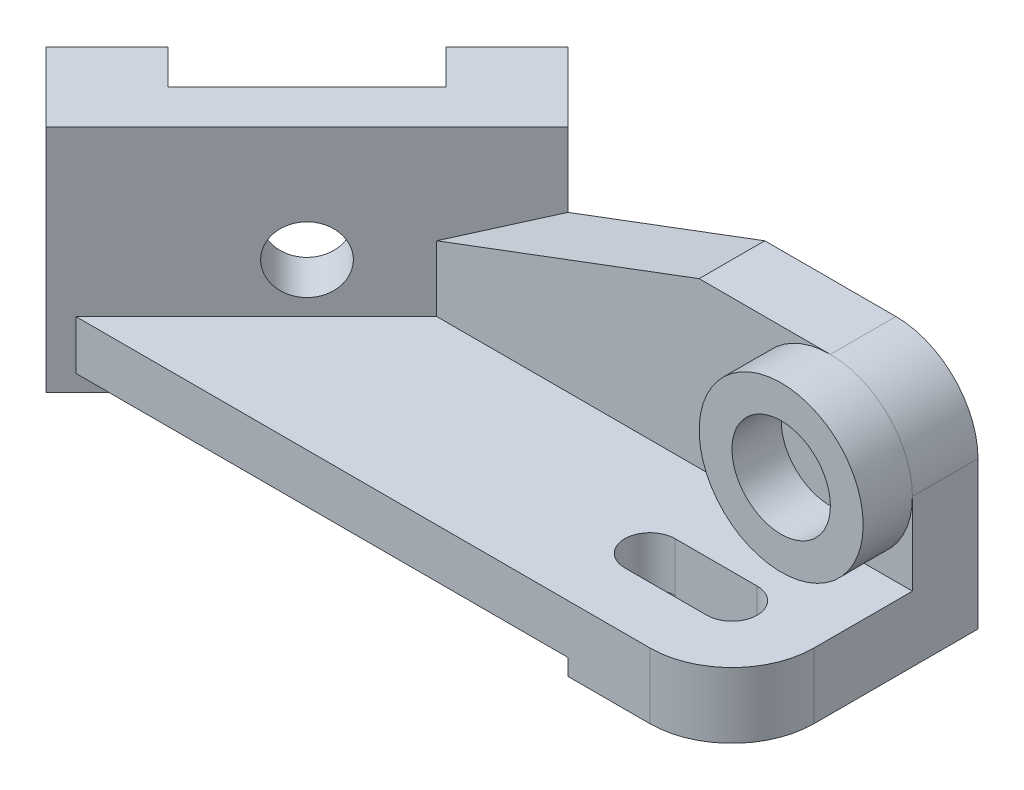
from build123d import *

# Parameters (mm, degrees)
BOSS_EXTRUDE1_DEPTH  = 150
FILLET1_R            = 50
CUT_EXTRUDE1_REACH   = 431.069
CUT_EXTRUDE2_DEPTH   = 430.068759058
BOSS_EXTRUDE2_DEPTH  = 140
CUT_EXTRUDE3_DEPTH   = 225
CUT_EXTRUDE4_REACH   = 356.524
SKETCH7_R            = 20
BOSS_EXTRUDE3_DEPTH  = 100
SKETCH11_R           = 50
BOSS_EXTRUDE9_DEPTH  = 30
BOSS_EXTRUDE9_TAPER  = 0.01
FILLET3_R            = 50
SKETCH12_R           = 30
CUT_EXTRUDE5_DEPTH   = 30
CUT_EXTRUDE7_REACH   = 489.504
BOSS_EXTRUDE11_REACH = 512.395
CUT_EXTRUDE8_DEPTH   = 490.482620533


with BuildPart() as part:
    # Sketch1 → Boss-Extrude1 (new body)
    with BuildSketch(Plane.XY):
        Polygon((0, 0), (-100, 0), (-100, 10), (-400, 10), (-400, 40), (0, 40), align=None)
    extrude(amount=-BOSS_EXTRUDE1_DEPTH)

    # Fillet1
    fillet1_edges = [part.edges().sort_by_distance(p)[0] for p in [
        (0, 20, 0),
    ]]
    fillet(fillet1_edges, radius=FILLET1_R)

    # Sketch3 → Cut-Extrude1 (cut, up to next)
    with BuildSketch(Plane(origin=(0, 40, 0), x_dir=(1, 0, 0), z_dir=(0, 1, 0)), mode=Mode.PRIVATE) as cut_extrude1_sk1:
        Polygon((-400, 0), (-250, 150), (-400, 150), align=None)
    cut_extrude1_tool1 = extrude(cut_extrude1_sk1.sketch, amount=-CUT_EXTRUDE1_REACH, mode=Mode.PRIVATE) & part.part
    add(cut_extrude1_tool1.solids().sort_by_distance((-350, 40, -100))[0], mode=Mode.SUBTRACT)

    # Sketch4 → Cut-Extrude2 (cut, through all)
    with BuildSketch(Plane(origin=(0, 40, 0), x_dir=(1, 0, 0), z_dir=(0, 1, 0))):
        with BuildLine():
            Line((-50, 34.621352916), (-100, 34.621352916))
            ThreePointArc((-100, 34.621352916), (-115.378647084, 50), (-100, 65.378647084))
            Line((-100, 65.378647084), (-50, 65.378647084))
            ThreePointArc((-50, 65.378647084), (-34.621352916, 50), (-50, 34.621352916))
        make_face()
    extrude(amount=-CUT_EXTRUDE2_DEPTH, mode=Mode.SUBTRACT)

    # Sketch5 → Boss-Extrude2 (add)
    with BuildSketch(Plane(origin=(0, 0, 0), x_dir=(1, 0, 0), z_dir=(0, 1, 0))):
        Polygon((-292.426406871, 192.426406871), (-250, 150), (-409.099025767, -9.099025767), (-451.525432638, 33.327381104), (-414.402326626, 70.450487117), (-393.18912319, 49.237283681), (-308.336309448, 134.090097423), (-329.549512883, 155.303300859), align=None)
    extrude(amount=BOSS_EXTRUDE2_DEPTH)

    # Sketch6 → Cut-Extrude3 (cut)
    with BuildSketch(Plane(origin=(-209.099025767, 0, 209.099025767), x_dir=(0.7071067811865476, 0, 0.7071067811865476), z_dir=(-0.7071067811865476, 0, 0.7071067811865476))):
        Polygon((-342.842712475, 120), (-312.842712475, 100), (-312.842712475, 40), (-342.842712475, 20), align=None)
    extrude(amount=-CUT_EXTRUDE3_DEPTH, mode=Mode.SUBTRACT)

    # Sketch7 → Cut-Extrude4 (cut, up to next)
    with BuildSketch(Plane(origin=(-221.213203436, 0, -221.213203436), x_dir=(-0.7071067811865476, 0, 0.7071067811865476), z_dir=(-0.7071067811865476, 0, -0.7071067811865476)), mode=Mode.PRIVATE) as cut_extrude4_sk1:
        with Locations((183.210678119, 70)):
            Circle(SKETCH7_R)
    cut_extrude4_tool1 = extrude(cut_extrude4_sk1.sketch, amount=-CUT_EXTRUDE4_REACH, mode=Mode.PRIVATE) & part.part
    add(cut_extrude4_tool1.solids().sort_by_distance((-350.762716, 70, -91.663691))[0], mode=Mode.SUBTRACT)

    # Sketch8 → Boss-Extrude3 (add)
    with BuildSketch(Plane(origin=(0, 40, 0), x_dir=(1, 0, 0), z_dir=(0, 1, 0))):
        Polygon((0, 150), (0, 110), (-290, 110), (-250, 150), align=None)
    extrude(amount=BOSS_EXTRUDE3_DEPTH)

    # Sketch11 → Boss-Extrude9 (add)
    with BuildSketch(Plane.XY.offset(-110)):
        with Locations((-50, 90)):
            Circle(SKETCH11_R)
    extrude(amount=BOSS_EXTRUDE9_DEPTH, taper=BOSS_EXTRUDE9_TAPER)

    # Fillet3
    fillet3_edges = [part.edges().sort_by_distance(p)[0] for p in [
        (0, 140, -130),
    ]]
    fillet(fillet3_edges, radius=FILLET3_R)

    # Sketch12 → Cut-Extrude5 (cut)
    with BuildSketch(Plane.XY.offset(-110)):
        with Locations((-50, 90)):
            Circle(SKETCH12_R)
    extrude(amount=CUT_EXTRUDE5_DEPTH, mode=Mode.SUBTRACT)

    # Sketch13 → Cut-Extrude7 (cut, up to next)
    with BuildSketch(Plane.XY.offset(-110), mode=Mode.PRIVATE) as cut_extrude7_sk1:
        Polygon((-290, 80), (-130, 140), (-290, 140), align=None)
    cut_extrude7_tool1 = extrude(cut_extrude7_sk1.sketch, amount=-CUT_EXTRUDE7_REACH, mode=Mode.PRIVATE) & part.part
    add(cut_extrude7_tool1.solids().sort_by_distance((-236.666667, 120, -110))[0], mode=Mode.SUBTRACT)

    # Boss-Extrude11: up to this plane
    boss_extrude11_end = Plane(origin=(-290, 80, -192.427406871), z_dir=(0.3511234415883917, -0.9363291775690445, 0))
    # Sketch16 → Boss-Extrude11 (add, up to the surface)
    with BuildSketch(Plane(origin=(0, 140, 0), x_dir=(1, 0, 0), z_dir=(0, 1, 0)), mode=Mode.PRIVATE) as boss_extrude11_sk1:
        Polygon((-290, 110), (-250, 150), (-290, 190), align=None)
    boss_extrude11_tool1 = split(extrude(boss_extrude11_sk1.sketch, amount=-BOSS_EXTRUDE11_REACH, mode=Mode.PRIVATE), bisect_by=boss_extrude11_end, keep=Keep.BOTH, mode=Mode.PRIVATE)
    add(boss_extrude11_tool1.solids().sort_by_distance((-276.666667, 140, -150))[0])

    # Sketch17 → Cut-Extrude8 (cut, through all)
    with BuildSketch(Plane(origin=(-50, 0, 50), x_dir=(-0.7071067811865461, 0, -0.7071067811865489), z_dir=(0.7071067811865489, 0, -0.7071067811865461))):
        Polygon((312.842712475, 80), (312.842712475, 100), (339.41125497, 117.712361663), (339.41125497, 80), align=None)
    extrude(amount=-CUT_EXTRUDE8_DEPTH, mode=Mode.SUBTRACT)


solid = part.part
